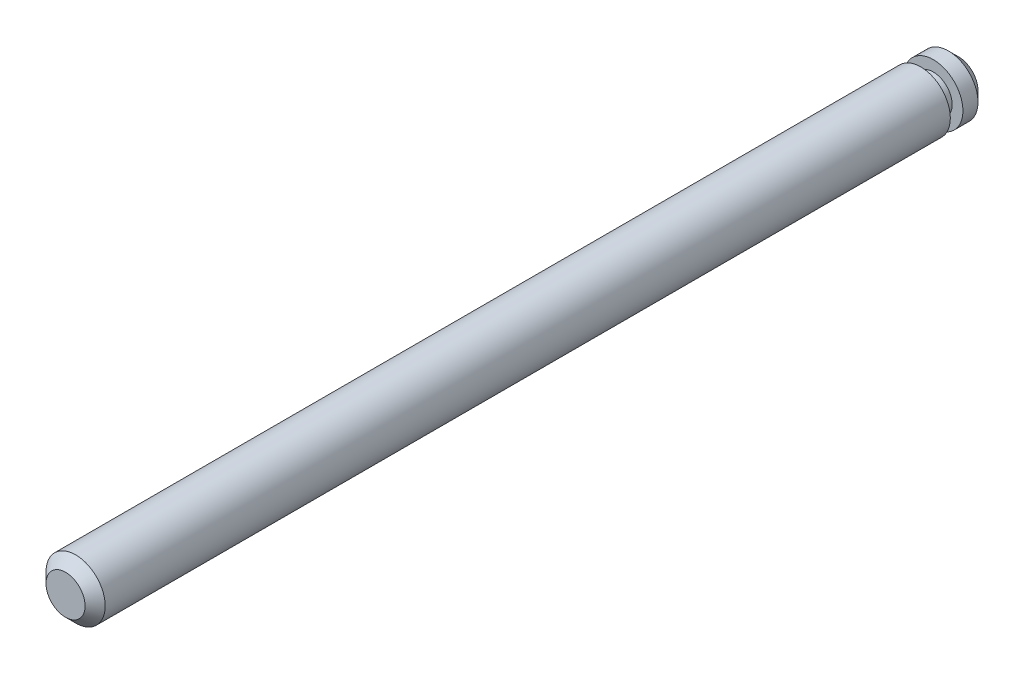
from build123d import *

# Parameters (mm, degrees)
SKETCH1_R      = 1.49479
EXTRUDE1_DEPTH = 43.18
SKETCH2_R      = 0.9525
EXTRUDE2_DEPTH = 0.635
EXTRUDE3_START = 1.27
SKETCH3_R      = 1.49479
EXTRUDE3_DEPTH = 1.27
CHAMFER1_SIZE  = 0.508


with BuildPart() as part:
    # Sketch1 → Extrude1 (new body)
    with BuildSketch(Plane.XY):
        Circle(SKETCH1_R)
    extrude(amount=EXTRUDE1_DEPTH)

    # Sketch2 → Extrude2 (add)
    with BuildSketch(Plane(origin=(0, 0, 0), x_dir=(-1, 0, 0), z_dir=(0, 0, -1))):
        with Locations(Location((0, 0, 0), (0, 0, 180))):
            Circle(SKETCH2_R)
    extrude(amount=EXTRUDE2_DEPTH)

    # Sketch3 → Extrude3 (add)
    with BuildSketch(Plane(origin=(0, 0, -0.635), x_dir=(-1, 0, 0), z_dir=(0, 0, -1)).offset(EXTRUDE3_START)):
        with Locations(Location((0, 0, 0), (0, 0, 180))):
            Circle(SKETCH3_R)
    extrude(amount=-EXTRUDE3_DEPTH)

    # Chamfer1
    chamfer1_edges = [part.edges().sort_by_distance(p)[0] for p in [
        (-1.49479, 0, -1.905),
        (-1.49479, 0, 43.18),
    ]]
    chamfer(chamfer1_edges, length=CHAMFER1_SIZE)


solid = part.part
